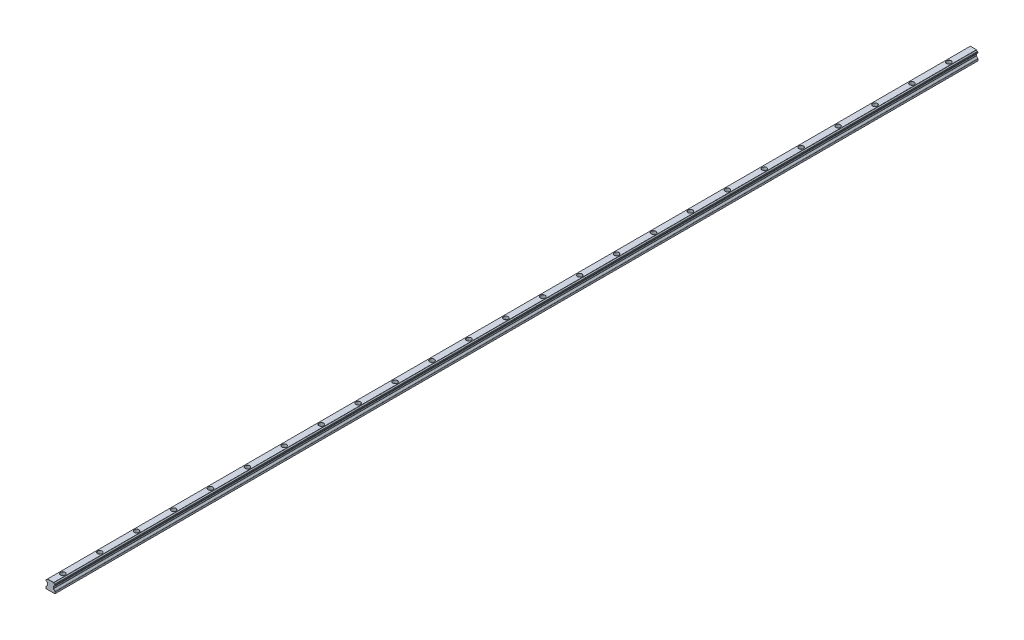
from build123d import *

# Parameters (mm, degrees)
BODY_DEPTH                                 = 1500
AESTHETIC_CHAMFER_SIZE                     = 0.15
PRODUCTION_FILLET_R                        = 0.1
MOUNTING_HOLES_PATTERN_COUNT               = 25
MOUNTING_HOLES_PATTERN_PITCH               = 60
PRODUCTION_FILLET_OF_MOUNTING_HOLES_PATT_R = 0.1


with BuildPart() as part:
    # Rail Profile → Body (new body)
    with BuildSketch(Plane.XY):
        with BuildLine():
            Line((-7, 0), (7, 0))
            Line((7, 0), (7.5, 0.5))
            Line((7.5, 0.5), (7.5, 3.085786438))
            ThreePointArc((7.5, 3.085786438), (7.423879533, 3.46846987), (7.207106781, 3.792893219))
            Line((7.207106781, 3.792893219), (4.867157288, 6.132842712))
            ThreePointArc((4.867157288, 6.132842712), (4.780448187, 6.262612052), (4.75, 6.415685425))
            Line((4.75, 6.415685425), (4.75, 8.584314575))
            ThreePointArc((4.75, 8.584314575), (4.780448187, 8.737387948), (4.867157288, 8.867157288))
            Line((4.867157288, 8.867157288), (5.062965362, 9.062965362))
            ThreePointArc((5.062965362, 9.062965362), (5.134996734, 9.161242682), (5.17409812, 9.27664646))
            ThreePointArc((5.17409812, 9.27664646), (5.61862915, 10.13137085), (6.47335354, 10.57590188))
            ThreePointArc((6.47335354, 10.57590188), (6.694124352, 10.694306692), (6.801170165, 10.920803148))
            ThreePointArc((6.801170165, 10.920803148), (6.915305692, 11.154571658), (7.149074202, 11.268707185))
            ThreePointArc((7.149074202, 11.268707185), (7.399691242, 11.400760606), (7.5, 11.665685425))
            Line((7.5, 11.665685425), (7.5, 12.334314575))
            ThreePointArc((7.5, 12.334314575), (7.399691242, 12.599239394), (7.149074202, 12.731292815))
            ThreePointArc((7.149074202, 12.731292815), (6.915305692, 12.845428342), (6.801170165, 13.079196852))
            ThreePointArc((6.801170165, 13.079196852), (6.694124352, 13.305693308), (6.47335354, 13.42409812))
            ThreePointArc((6.47335354, 13.42409812), (5.61862915, 13.86862915), (5.17409812, 14.72335354))
            ThreePointArc((5.17409812, 14.72335354), (5.134996734, 14.838757318), (5.062965362, 14.937034638))
            Line((5.062965362, 14.937034638), (5, 15))
            Line((5, 15), (-5, 15))
            Line((-5, 15), (-5.062965362, 14.937034638))
            ThreePointArc((-5.062965362, 14.937034638), (-5.134996734, 14.838757318), (-5.17409812, 14.72335354))
            ThreePointArc((-5.17409812, 14.72335354), (-5.61862915, 13.86862915), (-6.47335354, 13.42409812))
            ThreePointArc((-6.47335354, 13.42409812), (-6.694124352, 13.305693308), (-6.801170165, 13.079196852))
            ThreePointArc((-6.801170165, 13.079196852), (-6.915305692, 12.845428342), (-7.149074202, 12.731292815))
            ThreePointArc((-7.149074202, 12.731292815), (-7.399691242, 12.599239394), (-7.5, 12.334314575))
            Line((-7.5, 12.334314575), (-7.5, 11.665685425))
            ThreePointArc((-7.5, 11.665685425), (-7.399691242, 11.400760606), (-7.149074202, 11.268707185))
            ThreePointArc((-7.149074202, 11.268707185), (-6.915305692, 11.154571658), (-6.801170165, 10.920803148))
            ThreePointArc((-6.801170165, 10.920803148), (-6.694124352, 10.694306692), (-6.47335354, 10.57590188))
            ThreePointArc((-6.47335354, 10.57590188), (-5.61862915, 10.13137085), (-5.17409812, 9.27664646))
            ThreePointArc((-5.17409812, 9.27664646), (-5.134996734, 9.161242682), (-5.062965362, 9.062965362))
            Line((-5.062965362, 9.062965362), (-4.867157288, 8.867157288))
            ThreePointArc((-4.867157288, 8.867157288), (-4.780448187, 8.737387948), (-4.75, 8.584314575))
            Line((-4.75, 8.584314575), (-4.75, 6.415685425))
            ThreePointArc((-4.75, 6.415685425), (-4.780448187, 6.262612052), (-4.867157288, 6.132842712))
            Line((-4.867157288, 6.132842712), (-7.207106781, 3.792893219))
            ThreePointArc((-7.207106781, 3.792893219), (-7.423879533, 3.46846987), (-7.5, 3.085786438))
            Line((-7.5, 3.085786438), (-7.5, 0.5))
            Line((-7.5, 0.5), (-7, 0))
        make_face()
    extrude(amount=-BODY_DEPTH)

    # Aesthetic Chamfer
    aesthetic_chamfer_edges = [part.edges().sort_by_distance(p)[0] for p in [
        (7.423879533, 3.46846987, -1500),
        (-5.134996734, 9.161242682, -1500),
        (-4.965061325, 8.965061325, -1500),
        (-4.780448187, 8.737387948, -1500),
        (-4.75, 7.5, -1500),
        (-4.780448187, 6.262612052, -1500),
        (-6.037132034, 4.962867966, -1500),
        (-7.423879533, 3.46846987, -1500),
        (-7.5, 1.792893219, -1500),
        (-7.25, 0.25, -1500),
        (0, 0, -1500),
        (6.037132034, 4.962867966, -1500),
        (4.780448187, 6.262612052, -1500),
        (4.75, 7.5, -1500),
        (4.780448187, 8.737387948, -1500),
        (4.965061325, 8.965061325, -1500),
        (5.134996734, 9.161242682, -1500),
        (5.61862915, 10.13137085, -1500),
        (6.694124352, 10.694306692, -1500),
        (0, 0, 0),
        (-7.25, 0.25, 0),
        (-7.5, 1.792893219, 0),
        (-7.423879533, 3.46846987, 0),
        (-6.037132034, 4.962867966, 0),
        (-4.780448187, 6.262612052, 0),
        (6.915305692, 11.154571658, -1500),
        (-4.75, 7.5, 0),
        (-4.780448187, 8.737387948, 0),
        (-4.965061325, 8.965061325, 0),
        (-5.134996734, 9.161242682, 0),
        (-5.61862915, 10.13137085, 0),
        (-6.694124352, 10.694306692, 0),
        (-6.915305692, 11.154571658, 0),
        (7.25, 0.25, -1500),
        (7.399691242, 11.400760606, -1500),
        (-7.399691242, 11.400760606, 0),
        (-7.5, 12, 0),
        (-7.399691242, 12.599239394, 0),
        (-6.915305692, 12.845428342, 0),
        (-6.694124352, 13.305693308, 0),
        (-5.61862915, 13.86862915, 0),
        (-5.134996734, 14.838757318, 0),
        (-5.031482681, 14.968517319, 0),
        (7.5, 12, -1500),
        (0, 15, 0),
        (5.031482681, 14.968517319, 0),
        (5.134996734, 14.838757318, 0),
        (5.61862915, 13.86862915, 0),
        (6.694124352, 13.305693308, 0),
        (6.915305692, 12.845428342, 0),
        (7.399691242, 12.599239394, 0),
        (7.399691242, 12.599239394, -1500),
        (7.5, 12, 0),
        (7.399691242, 11.400760606, 0),
        (6.915305692, 11.154571658, 0),
        (6.694124352, 10.694306692, 0),
        (5.61862915, 10.13137085, 0),
        (5.134996734, 9.161242682, 0),
        (4.965061325, 8.965061325, 0),
        (4.780448187, 8.737387948, 0),
        (6.915305692, 12.845428342, -1500),
        (4.75, 7.5, 0),
        (4.780448187, 6.262612052, 0),
        (6.037132034, 4.962867966, 0),
        (7.423879533, 3.46846987, 0),
        (7.5, 1.792893219, 0),
        (7.25, 0.25, 0),
        (6.694124352, 13.305693308, -1500),
        (5.61862915, 13.86862915, -1500),
        (5.134996734, 14.838757318, -1500),
        (5.031482681, 14.968517319, -1500),
        (0, 15, -1500),
        (-5.031482681, 14.968517319, -1500),
        (7.5, 1.792893219, -1500),
        (-5.134996734, 14.838757318, -1500),
        (-5.61862915, 13.86862915, -1500),
        (-6.694124352, 13.305693308, -1500),
        (-6.915305692, 12.845428342, -1500),
        (-7.399691242, 12.599239394, -1500),
        (-7.5, 12, -1500),
        (-7.399691242, 11.400760606, -1500),
        (-6.915305692, 11.154571658, -1500),
        (-6.694124352, 10.694306692, -1500),
        (-5.61862915, 10.13137085, -1500),
    ]]
    chamfer(aesthetic_chamfer_edges, length=AESTHETIC_CHAMFER_SIZE)

    # Sketch1 → Mounting Hole (revolve, cut)
    with BuildSketch(Plane(origin=(0, 15, -20), x_dir=(0, 0, 1), z_dir=(1, 0, 0))):
        Polygon((0, 0), (0, 15), (2.35, 15), (2.25, 14.9), (2.25, 5.4), (2.35, 5.3), (3.75, 5.3), (3.75, 0.1), (3.85, 0), align=None)
    mounting_hole = revolve(axis=Axis((0, 21.35, -20), (0, -1, 0)), mode=Mode.SUBTRACT)

    # Production Fillet
    production_fillet_edges = [part.edges().sort_by_distance(p)[0] for p in [
        (0, 9.7, -23.75),
    ]]
    fillet(production_fillet_edges, radius=PRODUCTION_FILLET_R)

    # Mounting Holes Pattern: Mounting Hole ×25
    with Locations(*[(0, 0, -i * MOUNTING_HOLES_PATTERN_PITCH) for i in range(1, MOUNTING_HOLES_PATTERN_COUNT)]):
        add(mounting_hole, mode=Mode.SUBTRACT)

    # Production Fillet of Mounting Holes Patt
    production_fillet_of_mounting_holes_patt_edges = [part.edges().sort_by_distance(p)[0] for p in [
        (0, 9.7, -83.75),
        (0, 9.7, -143.75),
        (0, 9.7, -203.75),
        (0, 9.7, -263.75),
        (0, 9.7, -323.75),
        (0, 9.7, -383.75),
        (0, 9.7, -443.75),
        (0, 9.7, -503.75),
        (0, 9.7, -563.75),
        (0, 9.7, -623.75),
        (0, 9.7, -683.75),
        (0, 9.7, -743.75),
        (0, 9.7, -803.75),
        (0, 9.7, -863.75),
        (0, 9.7, -923.75),
        (0, 9.7, -983.75),
        (0, 9.7, -1043.75),
        (0, 9.7, -1103.75),
        (0, 9.7, -1163.75),
        (0, 9.7, -1223.75),
        (0, 9.7, -1283.75),
        (0, 9.7, -1343.75),
        (0, 9.7, -1403.75),
        (0, 9.7, -1463.75),
    ]]
    fillet(production_fillet_of_mounting_holes_patt_edges, radius=PRODUCTION_FILLET_OF_MOUNTING_HOLES_PATT_R)


solid = part.part
